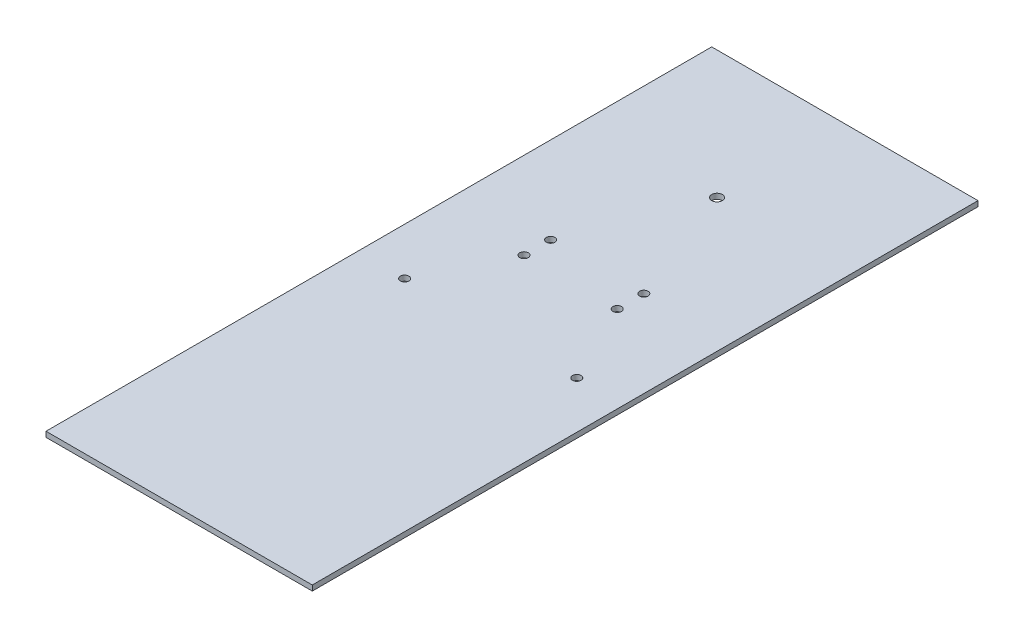
from build123d import *

# Parameters (mm, degrees)
SKETCH_1_W          = 100
SKETCH_1_H          = 400
EXTRUDE_1_DEPTH     = 2
CUT_EXTRUDE_2_REACH = 208.165
SKETCH_3_R          = 2
CUT_EXTRUDE_3_REACH = 208.165
SKETCH_4_R          = 1.6
CUT_EXTRUDE_4_REACH = 208.165
SKETCH_5_W          = 100
SKETCH_5_H          = 150


with BuildPart() as part:
    # 草图1 → 凸台-拉伸1 (new body)
    with BuildSketch(Plane(origin=(0, 0, 0), x_dir=(1, 0, 0), z_dir=(0, 1, 0))):
        Rectangle(SKETCH_1_W, SKETCH_1_H)
    extrude(amount=EXTRUDE_1_DEPTH)

    # 草图3 → 切除-拉伸2 (cut, up to next)
    with BuildSketch(Plane.XZ, mode=Mode.PRIVATE) as cut_extrude_2_sk1:
        with Locations(Location((0, -152, 0), (0, 0, 270))):
            Circle(SKETCH_3_R)
    cut_extrude_2_tool1 = extrude(cut_extrude_2_sk1.sketch, amount=-CUT_EXTRUDE_2_REACH, mode=Mode.PRIVATE) & part.part
    add(cut_extrude_2_tool1.solids().sort_by_distance((0, 0, -152))[0], mode=Mode.SUBTRACT)

    # 草图4 → 切除-拉伸3 (cut, up to next)
    with BuildSketch(Plane.XZ, mode=Mode.PRIVATE) as cut_extrude_3_sk1:
        with Locations(Location((17.5, -97, 0), (0, 0, 270))):
            Circle(SKETCH_4_R)
    cut_extrude_3_tool1 = extrude(cut_extrude_3_sk1.sketch, amount=-CUT_EXTRUDE_3_REACH, mode=Mode.PRIVATE) & part.part
    # 草图4 → 切除-拉伸3 (cut, up to next)
    with BuildSketch(Plane.XZ, mode=Mode.PRIVATE) as cut_extrude_3_sk2:
        with Locations(Location((17.5, -107, 0), (0, 0, 270))):
            Circle(SKETCH_4_R)
    cut_extrude_3_tool2 = extrude(cut_extrude_3_sk2.sketch, amount=-CUT_EXTRUDE_3_REACH, mode=Mode.PRIVATE) & part.part
    # 草图4 → 切除-拉伸3 (cut, up to next)
    with BuildSketch(Plane.XZ, mode=Mode.PRIVATE) as cut_extrude_3_sk3:
        with Locations(Location((32.32051615, -67, 0), (0, 0, 270))):
            Circle(SKETCH_4_R)
    cut_extrude_3_tool3 = extrude(cut_extrude_3_sk3.sketch, amount=-CUT_EXTRUDE_3_REACH, mode=Mode.PRIVATE) & part.part
    # 草图4 → 切除-拉伸3 (cut, up to next)
    with BuildSketch(Plane.XZ, mode=Mode.PRIVATE) as cut_extrude_3_sk4:
        with Locations(Location((-17.5, -97, 0), (0, 0, 270))):
            Circle(SKETCH_4_R)
    cut_extrude_3_tool4 = extrude(cut_extrude_3_sk4.sketch, amount=-CUT_EXTRUDE_3_REACH, mode=Mode.PRIVATE) & part.part
    # 草图4 → 切除-拉伸3 (cut, up to next)
    with BuildSketch(Plane.XZ, mode=Mode.PRIVATE) as cut_extrude_3_sk5:
        with Locations(Location((-17.5, -107, 0), (0, 0, 270))):
            Circle(SKETCH_4_R)
    cut_extrude_3_tool5 = extrude(cut_extrude_3_sk5.sketch, amount=-CUT_EXTRUDE_3_REACH, mode=Mode.PRIVATE) & part.part
    # 草图4 → 切除-拉伸3 (cut, up to next)
    with BuildSketch(Plane.XZ, mode=Mode.PRIVATE) as cut_extrude_3_sk6:
        with Locations(Location((-32.32051615, -67, 0), (0, 0, 270))):
            Circle(SKETCH_4_R)
    cut_extrude_3_tool6 = extrude(cut_extrude_3_sk6.sketch, amount=-CUT_EXTRUDE_3_REACH, mode=Mode.PRIVATE) & part.part
    add(cut_extrude_3_tool1.solids().sort_by_distance((17.5, 0, -97))[0], mode=Mode.SUBTRACT)
    add(cut_extrude_3_tool2.solids().sort_by_distance((17.5, 0, -107))[0], mode=Mode.SUBTRACT)
    add(cut_extrude_3_tool3.solids().sort_by_distance((32.320516, 0, -67))[0], mode=Mode.SUBTRACT)
    add(cut_extrude_3_tool4.solids().sort_by_distance((-17.5, 0, -97))[0], mode=Mode.SUBTRACT)
    add(cut_extrude_3_tool5.solids().sort_by_distance((-17.5, 0, -107))[0], mode=Mode.SUBTRACT)
    add(cut_extrude_3_tool6.solids().sort_by_distance((-32.320516, 0, -67))[0], mode=Mode.SUBTRACT)

    # 草图5 → 切除-拉伸4 (cut, up to next)
    with BuildSketch(Plane.XZ, mode=Mode.PRIVATE) as cut_extrude_4_sk1:
        with Locations((0, 125)):
            Rectangle(SKETCH_5_W, SKETCH_5_H)
    cut_extrude_4_tool1 = extrude(cut_extrude_4_sk1.sketch, amount=-CUT_EXTRUDE_4_REACH, mode=Mode.PRIVATE) & part.part
    add(cut_extrude_4_tool1.solids().sort_by_distance((0, 0, 125))[0], mode=Mode.SUBTRACT)


solid = part.part
